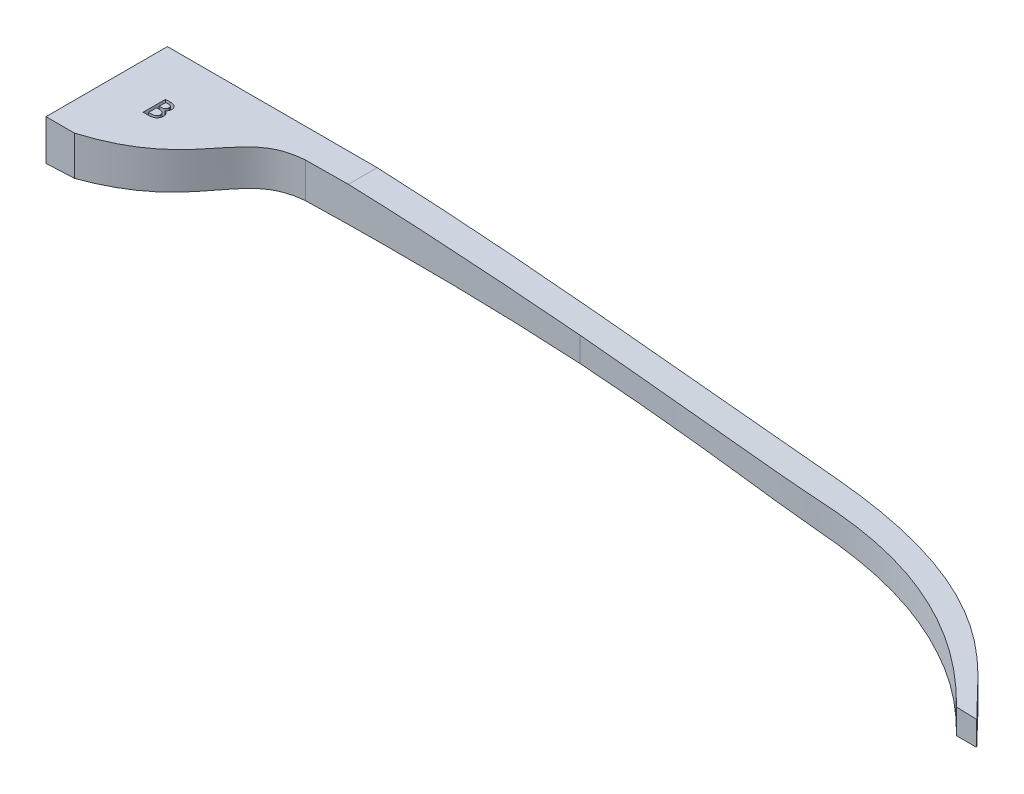
from build123d import *

# Parameters (mm, degrees)
SKETCH1_W           = 146.05
SKETCH1_H           = 19.05
BOSS_EXTRUDE1_DEPTH = 12.7
CUT_EXTRUDE6_DEPTH  = 1.905
CUT_EXTRUDE2_DEPTH  = 19.05
CUT_EXTRUDE3_DEPTH  = 148.833673551
SKETCH5_W           = 6.985
SKETCH5_H           = 3.81
CUT_EXTRUDE4_DEPTH  = 6.35


with BuildPart() as part:
    # Sketch1 → Boss-Extrude1 (new body)
    with BuildSketch(Plane(origin=(0, 0, 0), x_dir=(1, 0, 0), z_dir=(0, 1, 0))):
        with Locations((73.025, 9.525)):
            Rectangle(SKETCH1_W, SKETCH1_H)
    extrude(amount=BOSS_EXTRUDE1_DEPTH)

    # Sketch7 → Cut-Extrude6 (cut)
    with BuildSketch(Plane(origin=(0, 12.7, 0), x_dir=(1, 0, 0), z_dir=(0, 1, 0))):
        with BuildLine():
            Line((7.021582245, 11.726338147), (7.732519745, 11.726338147))
            add(Edge.make_bspline(
                [(7.732519745, 11.726338147), (7.767351807, 11.726218592), (7.834962419, 11.72598653), (7.933395877, 11.719914523), (8.025982459, 11.711555784), (8.112963788, 11.701022619), (8.193773984, 11.685098385), (8.268861244, 11.667377762), (8.33801144, 11.645611353), (8.421046136, 11.612266702), (8.516015967, 11.563101598), (8.616678787, 11.489253171), (8.704227668, 11.402794316), (8.776644871, 11.304005442), (8.833933827, 11.196836315), (8.876027101, 11.084259211), (8.901212391, 10.966965773), (8.904530141, 10.88721423), (8.90619763, 10.847131416)],
                knots=[0, 0, 0, 0, 1.007958579, 1.956493294, 2.853051435, 3.69876748, 4.490758369, 5.235590101, 5.930857791, 6.586533057, 7.824014415, 9.014592828, 10.186442765, 11.371570779, 12.545761065, 13.692928573, 14.840474926, 16, 16, 16, 16], degree=3))
            add(Edge.make_bspline(
                [(8.90619763, 10.847131416), (8.904766857, 10.809654958), (8.901939114, 10.735587436), (8.881846935, 10.626383451), (8.848123665, 10.521496836), (8.801058781, 10.422566851), (8.74419035, 10.331219213), (8.674102592, 10.253397966), (8.595309102, 10.187106212), (8.535253721, 10.155059266), (8.505155963, 10.138998403)],
                knots=[0, 0, 0, 0, 1.049068526, 2.073352407, 3.097740801, 4.125217979, 5.134529868, 6.0985968, 7.047080017, 8, 8, 8, 8], degree=3))
            add(Edge.make_bspline(
                [(8.505155963, 10.138998403), (8.540961141, 10.127110484), (8.610625857, 10.103980631), (8.708183165, 10.057824586), (8.796510338, 10.003998396), (8.874740074, 9.941060401), (8.943311602, 9.871234152), (9.004437452, 9.796476087), (9.0565501, 9.715620436), (9.098915864, 9.628989245), (9.133862816, 9.538908743), (9.157166399, 9.444861127), (9.172743218, 9.348418131), (9.174527867, 9.282990634), (9.175428399, 9.249975967)],
                knots=[0, 0, 0, 0, 1.133419977, 2.205250392, 3.236826218, 4.236512947, 5.215313127, 6.174419893, 7.135300951, 8.100002318, 9.069604306, 10.034177721, 11.008047523, 12, 12, 12, 12], degree=3))
            add(Edge.make_bspline(
                [(9.175428399, 9.249975967), (9.174490665, 9.215806197), (9.172638373, 9.148311144), (9.157728408, 9.048772743), (9.132030813, 8.953142928), (9.097890172, 8.860445778), (9.05244429, 8.771845982), (8.997478204, 8.686597242), (8.93246457, 8.605077112), (8.858768737, 8.527616816), (8.776176083, 8.456670278), (8.685559242, 8.394990456), (8.587768633, 8.342668856), (8.482823647, 8.299661309), (8.370125468, 8.267119406), (8.25055066, 8.243205526), (8.123845335, 8.229188328), (8.037075248, 8.227303475), (7.992635931, 8.226338147)],
                knots=[0, 0, 0, 0, 0.936774787, 1.85039767, 2.752028152, 3.648404466, 4.554125646, 5.47676296, 6.425627069, 7.40928418, 8.404729492, 9.405524488, 10.409085955, 11.440939351, 12.509690097, 13.620780345, 14.781482169, 16, 16, 16, 16], degree=3))
            Line((7.992635931, 8.226338147), (7.021582245, 8.226338147))
            Line((7.021582245, 8.226338147), (7.021582245, 11.726338147))
        make_face()
        with BuildLine():
            Line((7.470300194, 11.322491993), (7.470300194, 10.290440711))
            Line((7.470300194, 10.290440711), (7.583180803, 10.290440711))
            add(Edge.make_bspline(
                [(7.583180803, 10.290440711), (7.612400084, 10.290418657), (7.668525639, 10.290376296), (7.749621521, 10.294410255), (7.82447081, 10.298920775), (7.893264586, 10.30578604), (7.955643066, 10.315099433), (8.012256599, 10.325074778), (8.062278099, 10.338440186), (8.120327091, 10.357771252), (8.184544733, 10.388472102), (8.253760172, 10.433652854), (8.314092984, 10.488321306), (8.364934933, 10.551482161), (8.406660049, 10.620641803), (8.436044636, 10.694809944), (8.454598645, 10.772603379), (8.456509665, 10.82575907), (8.457479681, 10.85274039)],
                knots=[0, 0, 0, 0, 1.189795604, 2.285406617, 3.306016107, 4.243629591, 5.09972607, 5.874440047, 6.583200089, 7.20625147, 8.364329942, 9.470433385, 10.562068177, 11.665054906, 12.761988123, 13.838370909, 14.902777763, 16, 16, 16, 16], degree=3))
            add(Edge.make_bspline(
                [(8.457479681, 10.85274039), (8.457229395, 10.870538725), (8.45673943, 10.905381014), (8.448432617, 10.955782717), (8.436870123, 11.003726928), (8.419143735, 11.048260644), (8.397276639, 11.090234443), (8.370451882, 11.129328718), (8.337837117, 11.16476356), (8.301256954, 11.198294827), (8.258773672, 11.228072328), (8.209902859, 11.252888498), (8.155425612, 11.275127151), (8.094349496, 11.291921387), (8.027228451, 11.306289783), (7.953831826, 11.315689938), (7.87423271, 11.321220191), (7.819234792, 11.322057674), (7.790712854, 11.322491993)],
                knots=[0, 0, 0, 0, 0.920588044, 1.802157111, 2.638793445, 3.470424406, 4.277107445, 5.086238418, 5.917516993, 6.765890369, 7.652348103, 8.594329737, 9.598999334, 10.694623565, 11.869668103, 13.151790333, 14.522917531, 16, 16, 16, 16], degree=3))
            Line((7.790712854, 11.322491993), (7.470300194, 11.322491993))
        make_face(mode=Mode.SUBTRACT)
        with BuildLine():
            Line((7.470300194, 9.886594557), (7.470300194, 8.630184301))
            Line((7.470300194, 8.630184301), (7.813849873, 8.630184301))
            add(Edge.make_bspline(
                [(7.813849873, 8.630184301), (7.843998374, 8.630576964), (7.902204196, 8.631335053), (7.98617859, 8.633634812), (8.063798816, 8.639455929), (8.134902678, 8.64699727), (8.19984602, 8.656417583), (8.257741519, 8.66930138), (8.30976781, 8.682911241), (8.369647563, 8.705145839), (8.436663498, 8.73962953), (8.509531045, 8.789578745), (8.572795158, 8.850693579), (8.627251618, 8.919814525), (8.671585266, 8.995188148), (8.703146064, 9.07490131), (8.723172067, 9.157381592), (8.725526936, 9.213405783), (8.72671045, 9.241562506)],
                knots=[0, 0, 0, 0, 1.163785926, 2.246848597, 3.241725633, 4.167152819, 5.00659376, 5.772700295, 6.455464292, 7.08048881, 8.234268396, 9.355318846, 10.478218647, 11.615125307, 12.742977958, 13.840148171, 14.914498376, 16, 16, 16, 16], degree=3))
            add(Edge.make_bspline(
                [(8.72671045, 9.241562506), (8.725303614, 9.276808393), (8.722540554, 9.34603214), (8.694375132, 9.445723963), (8.650327112, 9.538638153), (8.58884773, 9.623458603), (8.51208461, 9.698963699), (8.420395563, 9.761706772), (8.315099265, 9.81132909), (8.238872324, 9.833213908), (8.19946686, 9.844527249)],
                knots=[0, 0, 0, 0, 0.973192407, 1.911372656, 2.842841623, 3.806662698, 4.794486549, 5.808057144, 6.866876674, 8, 8, 8, 8], degree=3))
            add(Edge.make_bspline(
                [(8.19946686, 9.844527249), (8.183140213, 9.847985354), (8.148085985, 9.855410098), (8.090881467, 9.863222882), (8.025980762, 9.871386972), (7.952695862, 9.876246312), (7.871410423, 9.881747733), (7.781835285, 9.88380993), (7.684156121, 9.88632595), (7.616369606, 9.886502591), (7.581077437, 9.886594557)],
                knots=[0, 0, 0, 0, 0.644909758, 1.384657469, 2.230684102, 3.173004705, 4.222865052, 5.379792601, 6.635823043, 8, 8, 8, 8], degree=3))
            Line((7.581077437, 9.886594557), (7.470300194, 9.886594557))
        make_face(mode=Mode.SUBTRACT)
    extrude(amount=-CUT_EXTRUDE6_DEPTH, mode=Mode.SUBTRACT)

    # Sketch4 → Cut-Extrude2 (cut)
    with BuildSketch(Plane(origin=(0, 12.7, 0), x_dir=(1, 0, 0), z_dir=(0, 1, 0))):
        with BuildLine():
            add(Edge.make_bspline(
                [(4.476723392, 0), (17.725756487, 4.043101895), (17.090749047, 12.999753789), (25.262791442, 14.373397692), (26.219517358, 14.465775476)],
                knots=[0, 0, 0, 0, 0.256127126, 0.284585695, 0.284585695, 0.284585695, 0.284585695], degree=3))
            Line((4.476723392, 0), (142.875, 0))
            add(Edge.make_bspline(
                [(68.923918907, 14.861089556), (81.075041449, 14.855684794), (98.246564786, 14.797098309), (108.068516517, 14.713978549), (127.226778846, 16.049688466), (142.875, 0)],
                knots=[0.488488537, 0.488488537, 0.488488537, 0.488488537, 0.629203286, 0.700744717, 1, 1, 1, 1], degree=3))
            Line((68.923918907, 14.861089556), (26.219517358, 14.465775476))
        make_face()
        with BuildLine():
            add(Edge.make_bspline(
                [(105.157866441, 19.05), (131.491281961, 18.918345897), (139.296835945, 6.588803862), (146.05, 0)],
                knots=[0.010622627, 0.010622627, 0.010622627, 0.010622627, 1, 1, 1, 1], degree=3))
            Line((146.05, 0), (146.05, 19.05))
            Line((146.05, 19.05), (105.157866441, 19.05))
        make_face()
    extrude(amount=-CUT_EXTRUDE2_DEPTH, mode=Mode.SUBTRACT)

    # Sketch3 → Cut-Extrude3 (cut, through all)
    with BuildSketch(Plane(origin=(0, 0, -19.05), x_dir=(-1, 0, 0), z_dir=(0, 0, -1))):
        with BuildLine():
            Line((0, 0), (0, 6.35))
            add(Edge.make_bspline(
                [(0, 6.35), (-26.792555724, 7.554357911), (-70.582640147, 8.075906855), (-113.597935631, 0.755242521), (-130.173218605, 0)],
                knots=[0, 0, 0, 0, 0.551607579, 0.891791453, 0.891791453, 0.891791453, 0.891791453], degree=3))
            Line((-130.173218605, 0), (0, 0))
        make_face()
        with BuildLine():
            add(Edge.make_bspline(
                [(-32.920125632, 12.7), (-70.723909336, 11.068434617), (-108.186625812, 4.764833045), (-146.05, 3.81)],
                knots=[0.224420232, 0.224420232, 0.224420232, 0.224420232, 1, 1, 1, 1], degree=3))
            Line((-32.920125632, 12.7), (-146.05, 12.7))
            Line((-146.05, 12.7), (-146.05, 3.81))
        make_face()
    extrude(amount=-CUT_EXTRUDE3_DEPTH, mode=Mode.SUBTRACT)

    # Sketch5 → Cut-Extrude4 (cut)
    with BuildSketch(Plane.ZY):
        with Locations((-9.2075, 8.255)):
            Rectangle(SKETCH5_W, SKETCH5_H)
    extrude(amount=-CUT_EXTRUDE4_DEPTH, mode=Mode.SUBTRACT)


solid = part.part
